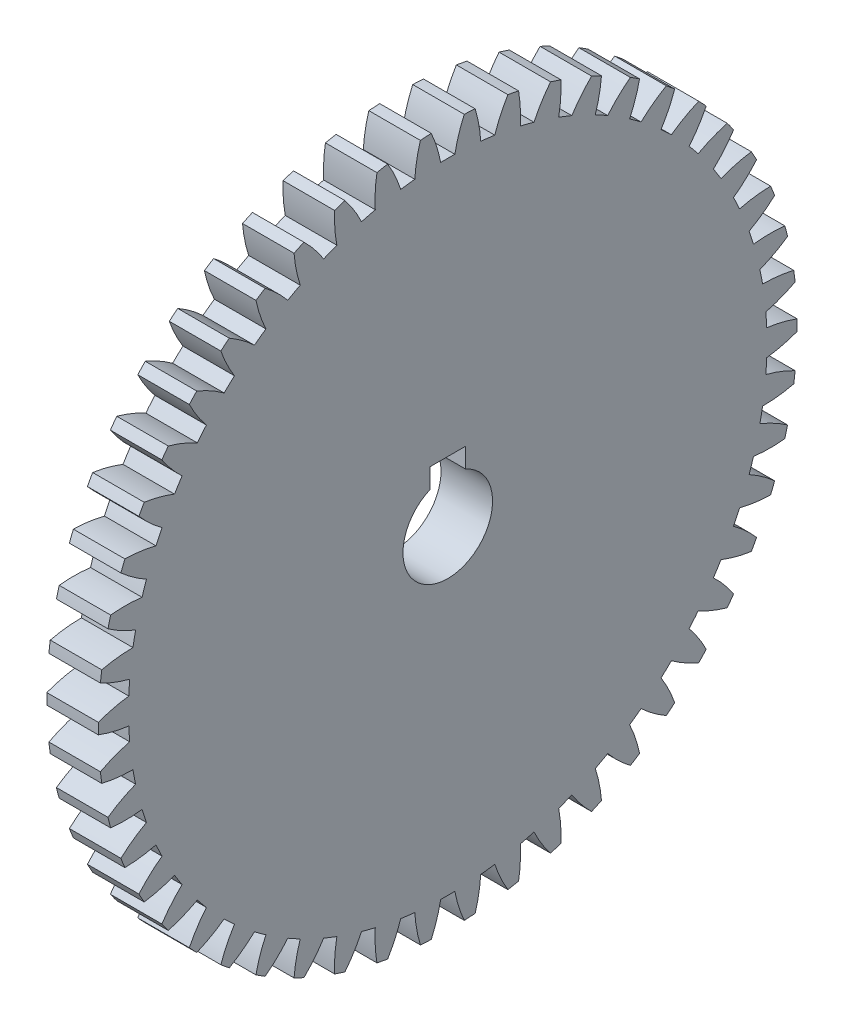
from build123d import *

# Parameters (mm, degrees)
BASPROSKE_W     = 5.75
BASPROSKE_H     = 39
TOOTHCUT_DEPTH  = 56.453246073
TEETHCUTS_COUNT = 50
TEETHCUTS_ANGLE = 352.8
BORSKE_R        = 5
BORE_DEPTH      = 50.0000508
KEYSKE_W        = 4
KEYSKE_H        = 6.8
KEYWAY_DEPTH    = 50.0000508


with BuildPart() as part:
    # BasProSke → Base-Revolve (revolve)
    with BuildSketch(Plane(origin=(0, 0, 0), x_dir=(1, 0, 0), z_dir=(0, 1, 0)), mode=Mode.PRIVATE) as base_revolve_sk:
        with Locations((2.875, 19.5)):
            Rectangle(BASPROSKE_W, BASPROSKE_H)
    revolve(base_revolve_sk.sketch.rotate(Axis((-10, 0, 0), (1, 0, 0)), 180), axis=Axis((-10, 0, 0), (1, 0, 0)))

    # TooCutSke → ToothCut (cut, through all)
    with BuildSketch(Plane(origin=(0, 0, 0), x_dir=(0, 0, -1), z_dir=(1, 0, 0))):
        with BuildLine():
            ThreePointArc((0.791295971, 35.615210608), (0, 35.624), (-0.791295971, 35.615210608))
            ThreePointArc((-0.791295971, 35.615210608), (-1.22284528, 37.32963518), (-1.853108687, 38.981378033))
            ThreePointArc((-1.853108687, 38.981378033), (0, 39.0254), (1.853108687, 38.981378033))
            ThreePointArc((1.853108687, 38.981378033), (1.22284528, 37.32963518), (0.791295971, 35.615210608))
        make_face()
    toothcut = extrude(amount=TOOTHCUT_DEPTH, mode=Mode.SUBTRACT)

    # TeethCuts: ToothCut ×50 about axis
    teethcuts_axis = Axis((-10, 0, 0), (1, 0, 0))
    for i in range(1, TEETHCUTS_COUNT):
        add(toothcut.rotate(teethcuts_axis, i * TEETHCUTS_ANGLE / (TEETHCUTS_COUNT - 1)), mode=Mode.SUBTRACT)

    # BorSke → Bore (cut, symmetric)
    with BuildSketch(Plane(origin=(0, 0, 0), x_dir=(0, 0, -1), z_dir=(1, 0, 0))):
        with Locations(Location((0, 0, 0), (0, 0, 180))):
            Circle(BORSKE_R)
    extrude(amount=BORE_DEPTH, both=True, mode=Mode.SUBTRACT)

    # KeySke → Keyway (cut, symmetric)
    with BuildSketch(Plane(origin=(0, 0, 0), x_dir=(0, 0, -1), z_dir=(1, 0, 0))):
        with Locations((0, 3.4)):
            Rectangle(KEYSKE_W, KEYSKE_H)
    extrude(amount=KEYWAY_DEPTH, both=True, mode=Mode.SUBTRACT)


solid = part.part
